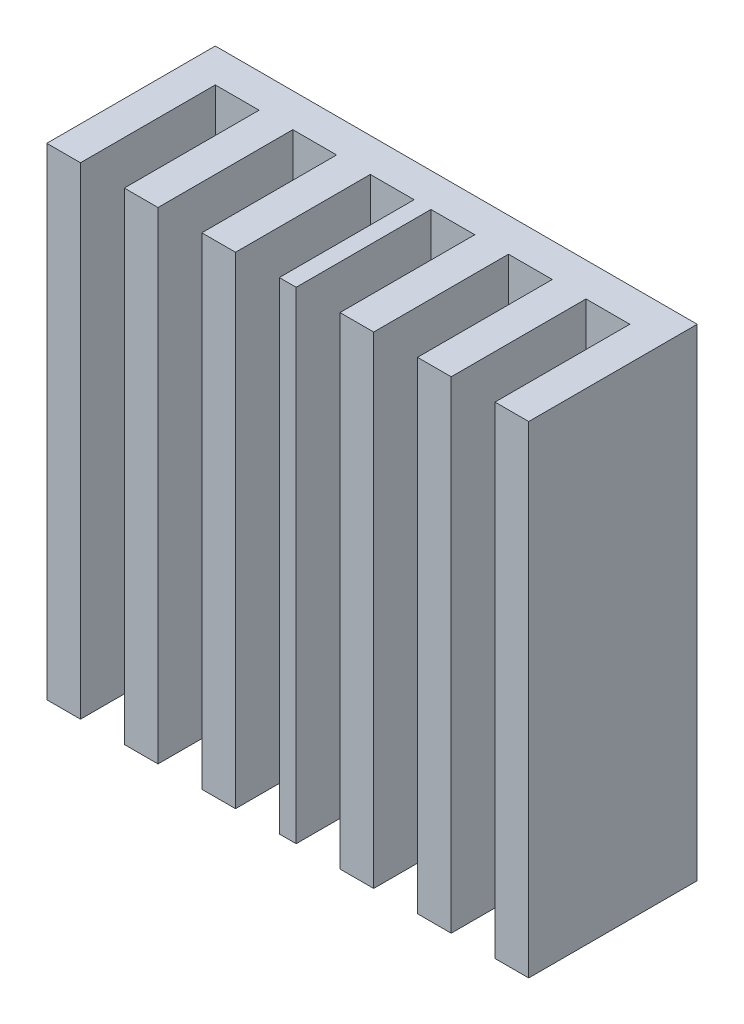
from build123d import *

# Parameters (mm, degrees)
ESQUISSE1_W             = 14.3
ESQUISSE1_H             = 14.3
BOSS_EXTRU_1_DEPTH      = 5
ESQUISSE2_W             = 1.3
ESQUISSE2_H             = 14.3
ENL_V_MAT_EXTRU_1_DEPTH = 4


with BuildPart() as part:
    # Esquisse1 → Boss.-Extru.1 (new body)
    with BuildSketch(Plane.XY):
        with Locations((7.15, 7.15)):
            Rectangle(ESQUISSE1_W, ESQUISSE1_H)
    extrude(amount=BOSS_EXTRU_1_DEPTH)

    # Esquisse2 → Enlèv. mat.-Extru.1 (cut)
    with BuildSketch(Plane.XY.offset(5)):
        with Locations((1.65, 7.15)):
            Rectangle(ESQUISSE2_W, ESQUISSE2_H)
        with Locations((8.05, 7.15)):
            Rectangle(ESQUISSE2_W, ESQUISSE2_H)
        with Locations((3.95, 7.15)):
            Rectangle(ESQUISSE2_W, ESQUISSE2_H)
        with Locations((6.25, 7.15)):
            Rectangle(ESQUISSE2_W, ESQUISSE2_H)
        with Locations((10.35, 7.15)):
            Rectangle(ESQUISSE2_W, ESQUISSE2_H)
        with Locations((12.65, 7.15)):
            Rectangle(ESQUISSE2_W, ESQUISSE2_H)
    extrude(amount=-ENL_V_MAT_EXTRU_1_DEPTH, mode=Mode.SUBTRACT)


solid = part.part
